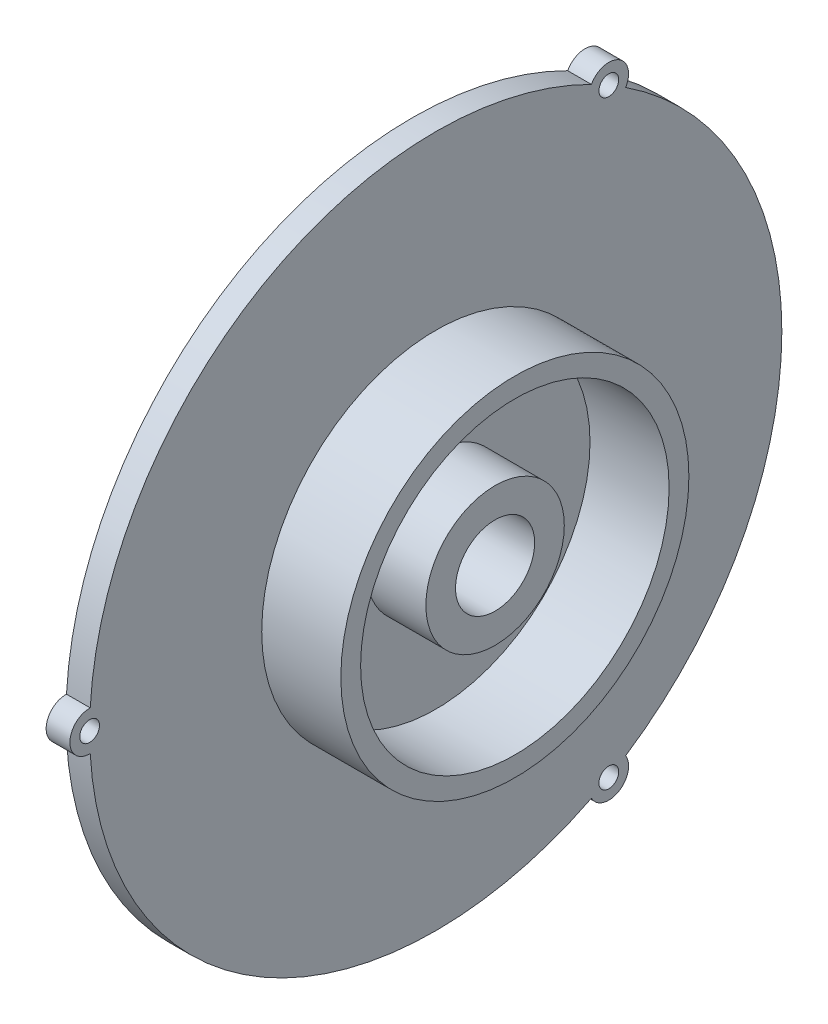
from build123d import *

# Parameters (mm, degrees)
SKETCH1_W           = 6
SKETCH1_H           = 87.5
SKETCH3_R           = 8
CUT_EXTRUDE2_DEPTH  = 30
SKETCH4_R           = 5
BOSS_EXTRUDE1_DEPTH = 6
CIRPATTERN2_COUNT   = 3
SKETCH6_R           = 2.5
CUT_EXTRUDE3_DEPTH  = 6
CIRPATTERN3_COUNT   = 3
SKETCH8_R           = 17.5
SKETCH8_R_2         = 10
BOSS_EXTRUDE2_DEPTH = 15
SKETCH10_R          = 44
SKETCH10_R_2        = 39
BOSS_EXTRUDE3_DEPTH = 20
SKETCH11_R          = 81.5
CUT_EXTRUDE4_DEPTH  = 3
SKETCH12_R          = 15
SKETCH12_R_2        = 8
BOSS_EXTRUDE4_DEPTH = 3


with BuildPart() as part:
    # Sketch1 → Revolve1 (revolve)
    with BuildSketch(Plane(origin=(0, 0, 0), x_dir=(-1, 0, 0), z_dir=(0, 1, 0)), mode=Mode.PRIVATE) as revolve1_sk:
        with Locations((3, 43.75)):
            Rectangle(SKETCH1_W, SKETCH1_H)
    revolve(revolve1_sk.sketch.rotate(Axis((38.11091851, 0, 0), (-1, 0, 0)), 180), axis=Axis((38.11091851, 0, 0), (-1, 0, 0)))

    # Sketch3 → Cut-Extrude2 (cut)
    with BuildSketch(Plane.YZ):
        with Locations(Location((0, 0, 0), (0, 0, 270))):
            Circle(SKETCH3_R)
    extrude(amount=-CUT_EXTRUDE2_DEPTH, mode=Mode.SUBTRACT)

    # Sketch4 → Boss-Extrude1 (add)
    with BuildSketch(Plane(origin=(-6, 0, 0), x_dir=(0, -1, 0), z_dir=(-1, 0, 0))):
        with Locations((0, 87.5)):
            Circle(SKETCH4_R)
    boss_extrude1 = extrude(amount=-BOSS_EXTRUDE1_DEPTH)

    # CirPattern2: Boss-Extrude1 ×3 about axis
    cirpattern2_axis = Axis((0, 0, 0), (1, 0, 0))
    for i in range(1, CIRPATTERN2_COUNT):
        add(boss_extrude1.rotate(cirpattern2_axis, i * 360 / CIRPATTERN2_COUNT))

    # Sketch6 → Cut-Extrude3 (cut)
    with BuildSketch(Plane(origin=(-6, 0, 0), x_dir=(0, -1, 0), z_dir=(-1, 0, 0))):
        with Locations(Location((0, 87.5, 0), (0, 0, 90))):
            Circle(SKETCH6_R)
    cut_extrude3 = extrude(amount=-CUT_EXTRUDE3_DEPTH, mode=Mode.SUBTRACT)

    # CirPattern3: Cut-Extrude3 ×3 about axis
    cirpattern3_axis = Axis((0, 0, 0), (1, 0, 0))
    for i in range(1, CIRPATTERN3_COUNT):
        add(cut_extrude3.rotate(cirpattern3_axis, i * 360 / CIRPATTERN3_COUNT), mode=Mode.SUBTRACT)

    # Sketch8 → Boss-Extrude2 (add)
    with BuildSketch(Plane.YZ):
        with Locations(Location((0, 0, 0), (0, 0, 90))):
            Circle(SKETCH8_R)
        with Locations(Location((0, 0, 0), (0, 0, 270))):
            Circle(SKETCH8_R_2, mode=Mode.SUBTRACT)
    extrude(amount=BOSS_EXTRUDE2_DEPTH)

    # Sketch10 → Boss-Extrude3 (add)
    with BuildSketch(Plane.YZ):
        with Locations(Location((0, 0, 0), (0, 0, 90))):
            Circle(SKETCH10_R)
        with Locations(Location((0, 0, 0), (0, 0, 270))):
            Circle(SKETCH10_R_2, mode=Mode.SUBTRACT)
    extrude(amount=BOSS_EXTRUDE3_DEPTH)

    # Sketch11 → Cut-Extrude4 (cut)
    with BuildSketch(Plane(origin=(-6, 0, 0), x_dir=(0, -1, 0), z_dir=(-1, 0, 0))):
        with Locations(Location((0, 0, 0), (0, 0, 90))):
            Circle(SKETCH11_R)
    extrude(amount=-CUT_EXTRUDE4_DEPTH, mode=Mode.SUBTRACT)

    # Sketch12 → Boss-Extrude4 (add)
    with BuildSketch(Plane(origin=(-3, 0, 0), x_dir=(0, -1, 0), z_dir=(-1, 0, 0))):
        with Locations(Location((0, 0, 0), (0, 0, 270))):
            Circle(SKETCH12_R)
        with Locations(Location((0, 0, 0), (0, 0, 270))):
            Circle(SKETCH12_R_2, mode=Mode.SUBTRACT)
    extrude(amount=BOSS_EXTRUDE4_DEPTH)


solid = part.part
